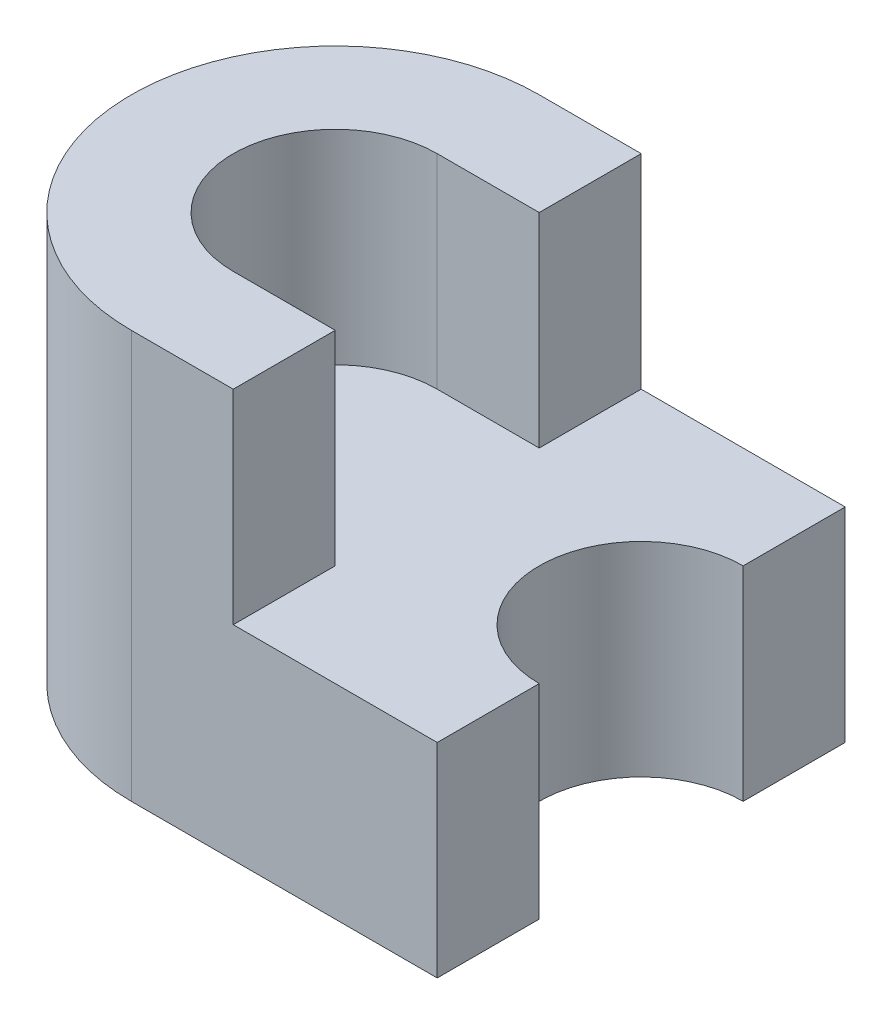
from build123d import *

# Parameters (mm, degrees)
BOSS_EXTRUDE1_DEPTH = 20
BOSS_EXTRUDE2_DEPTH = 20


with BuildPart() as part:
    # Sketch1 → Boss-Extrude1 (new body)
    with BuildSketch(Plane(origin=(0, 0, 0), x_dir=(1, 0, 0), z_dir=(0, 1, 0))):
        with BuildLine():
            Line((0, 20), (30, 20))
            Line((30, 20), (30, 10))
            ThreePointArc((30, 10), (20, 0), (30, -10))
            Line((30, -10), (30, -20))
            Line((30, -20), (0, -20))
            ThreePointArc((0, -20), (-20, 0), (0, 20))
        make_face()
    extrude(amount=BOSS_EXTRUDE1_DEPTH)

    # Sketch2 → Boss-Extrude2 (add)
    with BuildSketch(Plane(origin=(0, 20, 0), x_dir=(1, 0, 0), z_dir=(0, 1, 0))):
        with BuildLine():
            Line((0, 20), (10, 20))
            Line((10, 20), (10, 10))
            Line((10, 10), (0, 10))
            ThreePointArc((0, 10), (-10, 0), (0, -10))
            Line((0, -10), (10, -10))
            Line((10, -10), (10, -20))
            Line((10, -20), (0, -20))
            ThreePointArc((0, -20), (-20, 0), (0, 20))
        make_face()
    extrude(amount=BOSS_EXTRUDE2_DEPTH)


solid = part.part
